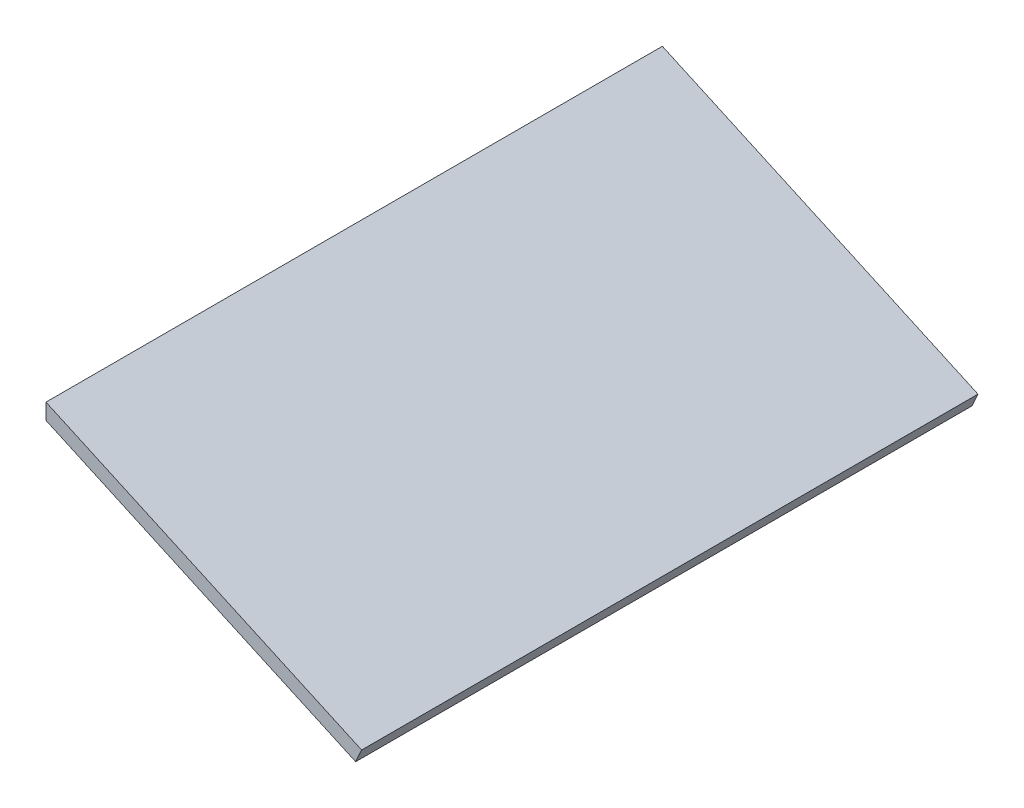
from build123d import *

# Parameters (mm, degrees)
BOSS_EXTRUDE1_DEPTH = 812.8


with BuildPart() as part:
    # Sketch6 → Boss-Extrude1 (new body)
    with BuildSketch(Plane.XY):
        Polygon((-737.18449825, 1672.01539481), (-737.18449825, 1692.941033519), (-320.964944754, 1503.750327384), (-328.847890843, 1486.407845989), align=None)
    extrude(amount=BOSS_EXTRUDE1_DEPTH)


solid = part.part
